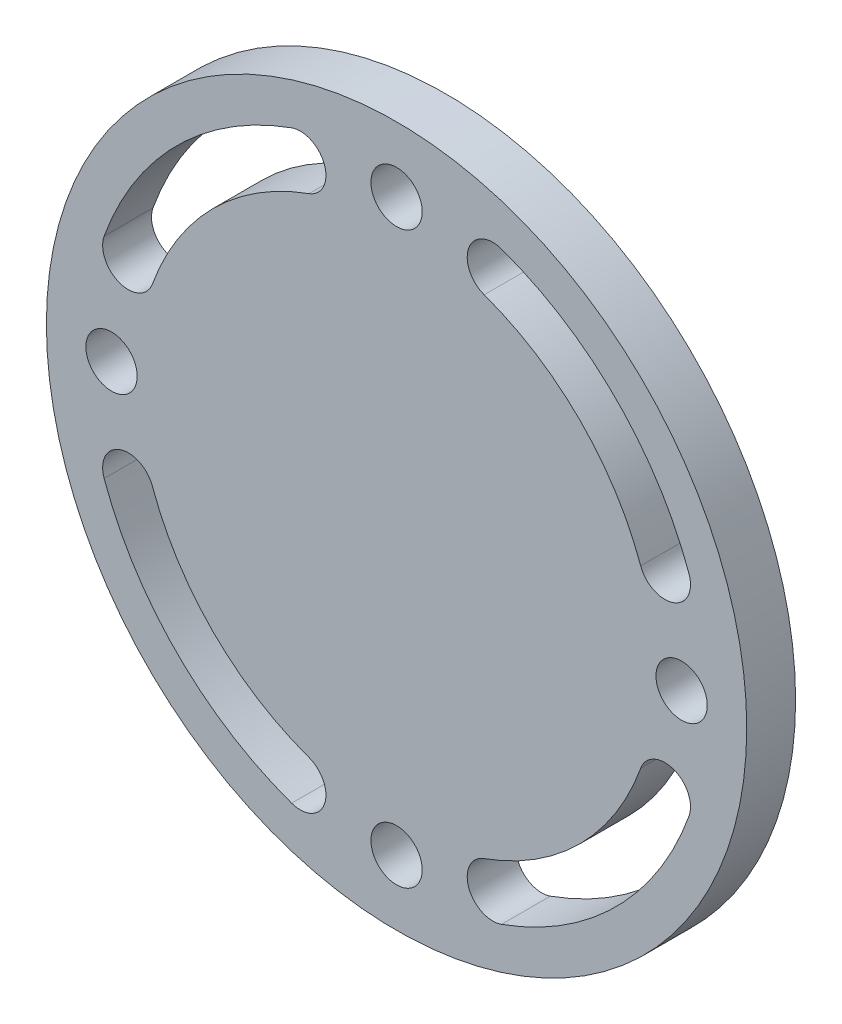
from build123d import *

# Parameters (mm, degrees)
SKETCH_1_R      = 21.5
SKETCH_1_R_2    = 1.575
EXTRUDE_1_DEPTH = 3


with BuildPart() as part:
    # 草图1 → 凸台-拉伸1 (new body)
    with BuildSketch(Plane.XY):
        Circle(SKETCH_1_R)
        with Locations((0, 17.5)):
            Circle(SKETCH_1_R_2, mode=Mode.SUBTRACT)
        with Locations((17.5, 0)):
            Circle(SKETCH_1_R_2, mode=Mode.SUBTRACT)
        with Locations((0, -17.5)):
            Circle(SKETCH_1_R_2, mode=Mode.SUBTRACT)
        with Locations((-17.5, 0)):
            Circle(SKETCH_1_R_2, mode=Mode.SUBTRACT)
        with BuildLine():
            ThreePointArc((-5.379173171, 14.989), (-4.428750737, 17.003434709), (-6.443185446, 17.953857143))
            ThreePointArc((-6.443185446, 17.953857143), (-13.488061851, 13.488061851), (-17.953857143, 6.443185446))
            ThreePointArc((-17.953857143, 6.443185446), (-17.003434709, 4.428750737), (-14.989, 5.379173171))
            ThreePointArc((-14.989, 5.379173171), (-11.26067549, 11.26067549), (-5.379173171, 14.989))
        make_face(mode=Mode.SUBTRACT)
        with BuildLine():
            ThreePointArc((5.379173171, 14.989), (11.26067549, 11.26067549), (14.989, 5.379173171))
            ThreePointArc((14.989, 5.379173171), (17.003434709, 4.428750737), (17.953857143, 6.443185446))
            ThreePointArc((17.953857143, 6.443185446), (13.488061851, 13.488061851), (6.443185446, 17.953857143))
            ThreePointArc((6.443185446, 17.953857143), (4.428750737, 17.003434709), (5.379173171, 14.989))
        make_face(mode=Mode.SUBTRACT)
        with BuildLine():
            ThreePointArc((5.379173171, -14.989), (4.428750737, -17.003434709), (6.443185446, -17.953857143))
            ThreePointArc((6.443185446, -17.953857143), (13.488061851, -13.488061851), (17.953857143, -6.443185446))
            ThreePointArc((17.953857143, -6.443185446), (17.003434709, -4.428750737), (14.989, -5.379173171))
            ThreePointArc((14.989, -5.379173171), (11.26067549, -11.26067549), (5.379173171, -14.989))
        make_face(mode=Mode.SUBTRACT)
        with BuildLine():
            ThreePointArc((-5.379173171, -14.989), (-11.26067549, -11.26067549), (-14.989, -5.379173171))
            ThreePointArc((-14.989, -5.379173171), (-17.003434709, -4.428750737), (-17.953857143, -6.443185446))
            ThreePointArc((-17.953857143, -6.443185446), (-13.488061851, -13.488061851), (-6.443185446, -17.953857143))
            ThreePointArc((-6.443185446, -17.953857143), (-4.428750737, -17.003434709), (-5.379173171, -14.989))
        make_face(mode=Mode.SUBTRACT)
    extrude(amount=EXTRUDE_1_DEPTH)


solid = part.part
